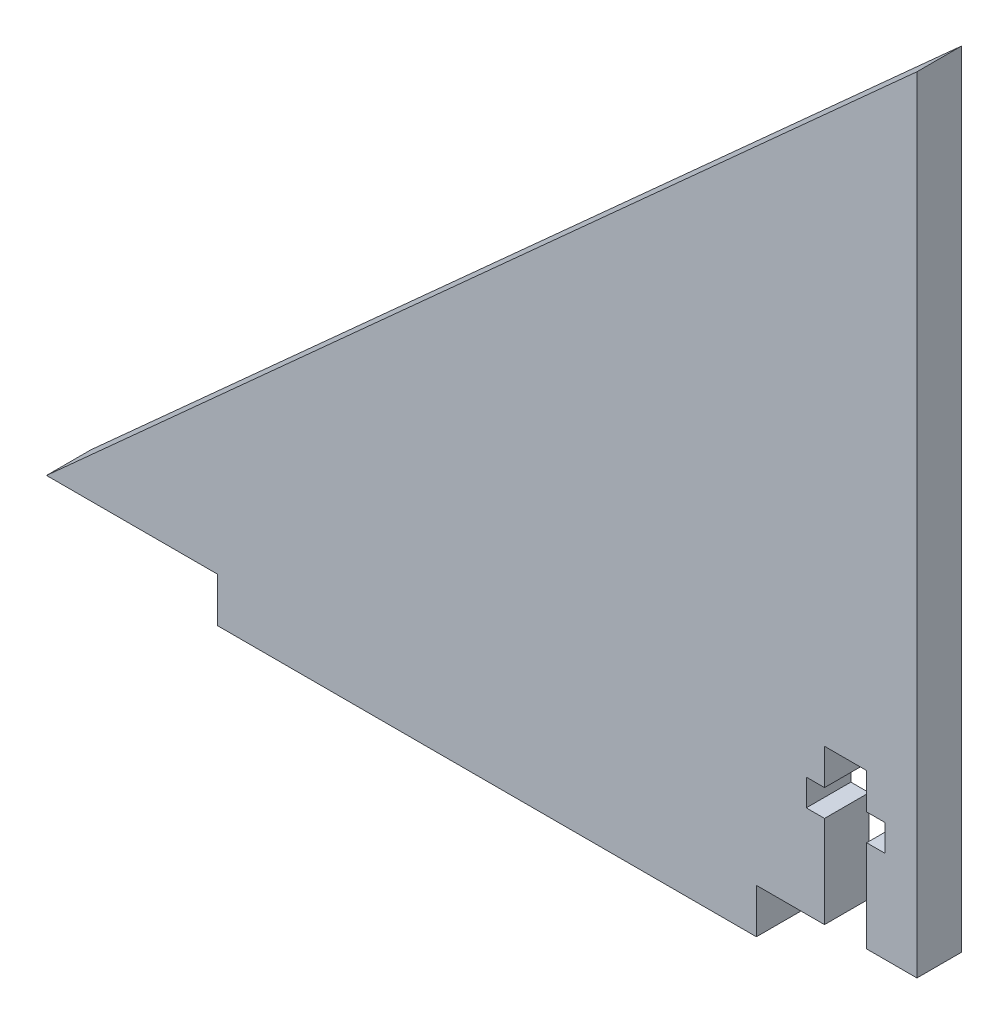
from build123d import *

# Parameters (mm, degrees)
BOSS_EXTRUDE1_DEPTH = 3.175
CUT_EXTRUDE1_DEPTH  = 84.508560046


with BuildPart() as part:
    # Sketch1 → Boss-Extrude1 (new body)
    with BuildSketch(Plane.XY):
        Polygon((-61.976, 0), (0, 55.88), (0, 0), (-11.43, 0), (-11.43, -3.175), (-49.784, -3.175), (-49.784, 0), align=None)
    extrude(amount=BOSS_EXTRUDE1_DEPTH)

    # Sketch2 → Cut-Extrude1 (cut, through all)
    with BuildSketch(Plane.XY.offset(3.175)):
        Polygon((-3.58, 11), (-3.58, 8.45), (-2.28, 8.45), (-2.28, 6.55), (-3.58, 6.55), (-3.58, 0), (-6.58, 0), (-6.58, 6.55), (-7.88, 6.55), (-7.88, 8.45), (-6.58, 8.45), (-6.58, 11), align=None)
    extrude(amount=-CUT_EXTRUDE1_DEPTH, mode=Mode.SUBTRACT)


solid = part.part
